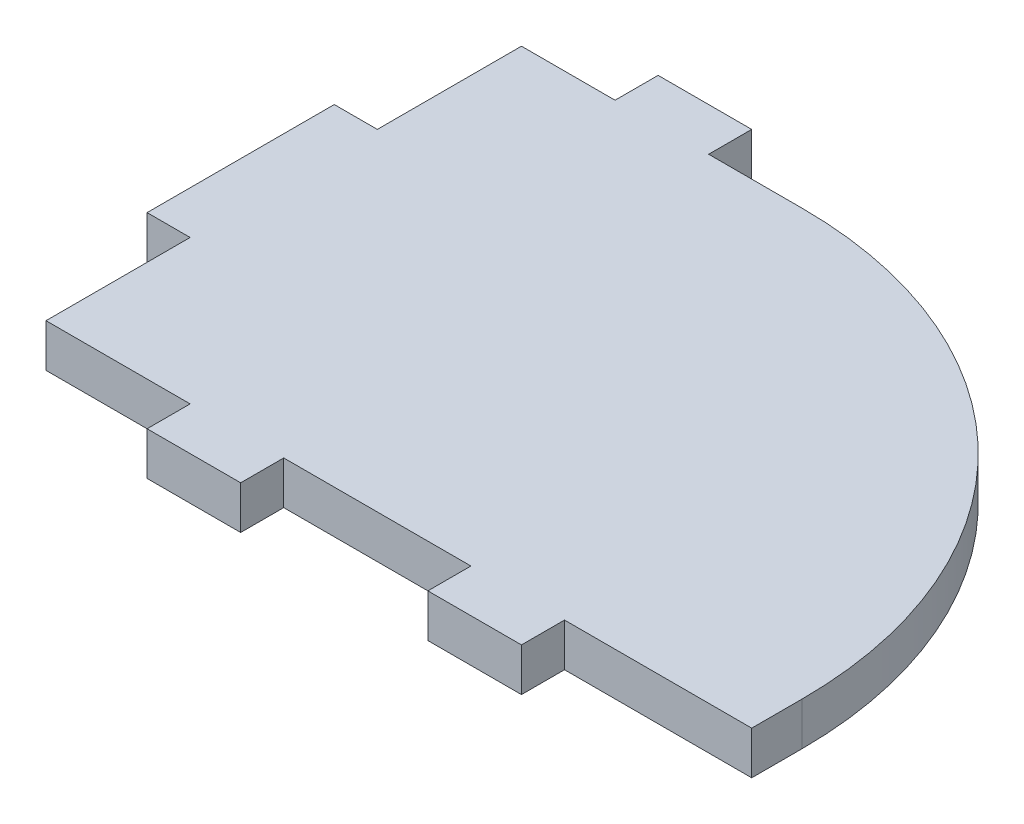
from build123d import *

# Parameters (mm, degrees)
SKETCH1_W          = 50.8
SKETCH1_H          = 38.1
EXTRUDE_2_DEPTH    = 2.921
FRONT_TABS_DEPTH   = 64.567147498
SIDE_TAB_DEPTH     = 64.567147498
CUT_EXTRUDE2_DEPTH = 64.567147498


with BuildPart() as part:
    # Sketch1 → extrude 2 (new body)
    with BuildSketch(Plane(origin=(0, 0, 0), x_dir=(1, 0, 0), z_dir=(0, 1, 0))):
        with Locations((25.4, 19.05)):
            Rectangle(SKETCH1_W, SKETCH1_H)
    extrude(amount=EXTRUDE_2_DEPTH)

    # Sketch2 → front tabs (cut, through all)
    with BuildSketch(Plane(origin=(0, 2.921, 0), x_dir=(1, 0, 0), z_dir=(0, 1, 0))):
        Polygon((0, -13.073373741), (50.8, -13.073373741), (50.8, 2.921), (38.1, 2.921), (38.1, -7.014658109), (31.75, -7.014658109), (31.75, 2.921), (19.05, 2.921), (19.05, -5.986156243), (12.7, -5.986156243), (12.7, 2.921), (0, 2.921), align=None)
    extrude(amount=-FRONT_TABS_DEPTH, mode=Mode.SUBTRACT)

    # Sketch3 → side tab (cut, through all)
    with BuildSketch(Plane(origin=(0, 2.921, 0), x_dir=(1, 0, 0), z_dir=(0, 1, 0))):
        Polygon((2.921, 25.4), (-4.31094219, 25.4), (-4.31094219, 12.7), (2.921, 12.7), (2.921, 0), (-6.847135587, 0), (-6.847135587, 38.1), (2.921, 38.1), align=None)
    extrude(amount=-SIDE_TAB_DEPTH, mode=Mode.SUBTRACT)

    # Sketch5 → Cut-Extrude2 (cut, through all)
    with BuildSketch(Plane(origin=(0, 2.921, 0), x_dir=(1, 0, 0), z_dir=(0, 1, 0))):
        with BuildLine():
            Line((-6.071846443, 35.179), (9.271, 35.179))
            Line((9.271, 35.179), (9.271, 42.517295463))
            Line((9.271, 42.517295463), (15.621, 42.517295463))
            Line((15.621, 42.517295463), (15.621, 35.179))
            Line((15.621, 35.179), (21.971, 35.179))
            ThreePointArc((21.971, 35.179), (42.356181395, 26.735181395), (50.8, 6.35))
            Line((50.8, 6.35), (50.8, 2.921))
            Line((50.8, 2.921), (62.623975616, 47.008361676))
            Line((62.623975616, 47.008361676), (-4.438145021, 50.333756088))
            Line((-4.438145021, 50.333756088), (-6.071846443, 35.179))
        make_face()
    extrude(amount=-CUT_EXTRUDE2_DEPTH, mode=Mode.SUBTRACT)


solid = part.part
